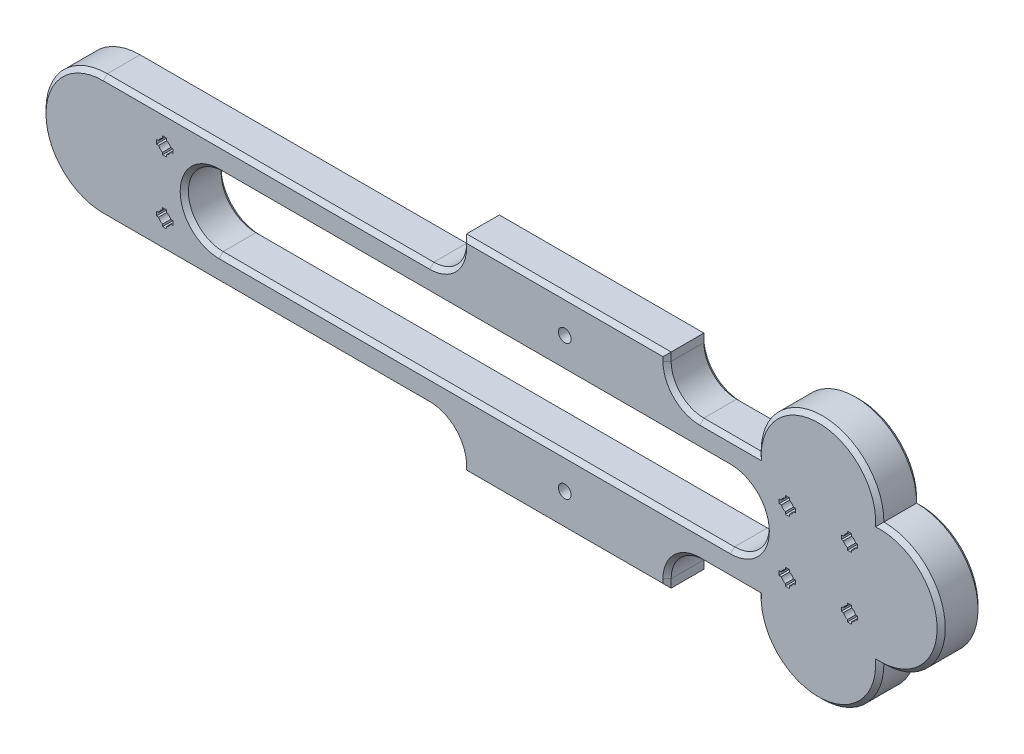
from build123d import *

# Parameters (mm, degrees)
SKETCH1_R           = 1.55
SKETCH1_W           = 57.8
SKETCH1_H           = 30
SKETCH1_W_2         = 22
SKETCH1_W_3         = 30
BOSS_EXTRUDE1_DEPTH = 10
FILLET2_R           = 8
CHAMFER1_SIZE       = 1
SKETCH2_R           = 3.25
CUT_EXTRUDE1_DEPTH  = 3
CUT_EXTRUDE2_DEPTH  = 137.363814848
CHAMFER2_SIZE       = 1


with BuildPart() as part:
    # Sketch1 → Boss-Extrude1 (new body)
    # profile 1 of 9: a face of its own
    with BuildSketch(Plane.XY):
        Polygon((-25, -31.5), (-25, -41.5), (25, -41.5), (25, -31.5), (25, -1.5), (25, 8.5), (-25, 8.5), (-25, -1.5), align=None)
        with Locations((0, -33)):
            Circle(SKETCH1_R, mode=Mode.SUBTRACT)
        Circle(SKETCH1_R, mode=Mode.SUBTRACT)
    # profile 2 of 9: a face of its own
    with BuildSketch(Plane.XY):
        with Locations((-53.9, -16.5)):
            Rectangle(SKETCH1_W, SKETCH1_H)
    # profile 3 of 9: a face of its own
    with BuildSketch(Plane.XY):
        with Locations((36, -16.5)):
            Rectangle(SKETCH1_W_2, SKETCH1_H)
    # profile 4 of 9: a face of its own
    with BuildSketch(Plane.XY):
        with Locations((-97.8, -16.5)):
            Rectangle(SKETCH1_W_3, SKETCH1_H)
        with BuildLine():
            Line((-99.8, -24.6), (-99.8, -23.6))
            Line((-99.8, -23.6), (-99.267140075, -23.6))
            ThreePointArc((-99.267140075, -23.6), (-98.896015511, -23.003984489), (-98.3, -22.632859925))
            Line((-98.3, -22.632859925), (-98.3, -22.1))
            Line((-98.3, -22.1), (-97.3, -22.1))
            Line((-97.3, -22.1), (-97.3, -22.632859925))
            ThreePointArc((-97.3, -22.632859925), (-96.703984489, -23.003984489), (-96.332859925, -23.6))
            Line((-96.332859925, -23.6), (-95.8, -23.6))
            Line((-95.8, -23.6), (-95.8, -24.6))
            Line((-95.8, -24.6), (-96.332859925, -24.6))
            ThreePointArc((-96.332859925, -24.6), (-96.703984489, -25.196015511), (-97.3, -25.567140075))
            Line((-97.3, -25.567140075), (-97.3, -26.1))
            Line((-97.3, -26.1), (-98.3, -26.1))
            Line((-98.3, -26.1), (-98.3, -25.567140075))
            ThreePointArc((-98.3, -25.567140075), (-98.896015511, -25.196015511), (-99.267140075, -24.6))
            Line((-99.267140075, -24.6), (-99.8, -24.6))
        make_face(mode=Mode.SUBTRACT)
        with BuildLine():
            Line((-97.3, -10.9), (-98.3, -10.9))
            Line((-98.3, -10.9), (-98.3, -10.367140075))
            ThreePointArc((-98.3, -10.367140075), (-98.896015511, -9.996015511), (-99.267140075, -9.4))
            Line((-99.267140075, -9.4), (-99.8, -9.4))
            Line((-99.8, -9.4), (-99.8, -8.4))
            Line((-99.8, -8.4), (-99.267140075, -8.4))
            ThreePointArc((-99.267140075, -8.4), (-98.896015511, -7.803984489), (-98.3, -7.432859925))
            Line((-98.3, -7.432859925), (-98.3, -6.9))
            Line((-98.3, -6.9), (-97.3, -6.9))
            Line((-97.3, -6.9), (-97.3, -7.432859925))
            ThreePointArc((-97.3, -7.432859925), (-96.703984489, -7.803984489), (-96.332859925, -8.4))
            Line((-96.332859925, -8.4), (-95.8, -8.4))
            Line((-95.8, -8.4), (-95.8, -9.4))
            Line((-95.8, -9.4), (-96.332859925, -9.4))
            ThreePointArc((-96.332859925, -9.4), (-96.703984489, -9.996015511), (-97.3, -10.367140075))
            Line((-97.3, -10.367140075), (-97.3, -10.9))
        make_face(mode=Mode.SUBTRACT)
    # profile 5 of 9: a face of its own
    with BuildSketch(Plane.XY):
        with Locations((62, -16.5)):
            Rectangle(SKETCH1_W_3, SKETCH1_H)
        with BuildLine():
            Line((55.867140075, -23.6), (56.4, -23.6))
            Line((56.4, -23.6), (56.4, -24.6))
            Line((56.4, -24.6), (55.867140075, -24.6))
            ThreePointArc((55.867140075, -24.6), (55.496015511, -25.196015511), (54.9, -25.567140075))
            Line((54.9, -25.567140075), (54.9, -26.1))
            Line((54.9, -26.1), (53.9, -26.1))
            Line((53.9, -26.1), (53.9, -25.567140075))
            ThreePointArc((53.9, -25.567140075), (53.303984489, -25.196015511), (52.932859925, -24.6))
            Line((52.932859925, -24.6), (52.4, -24.6))
            Line((52.4, -24.6), (52.4, -23.6))
            Line((52.4, -23.6), (52.932859925, -23.6))
            ThreePointArc((52.932859925, -23.6), (53.303984489, -23.003984489), (53.9, -22.632859925))
            Line((53.9, -22.632859925), (53.9, -22.1))
            Line((53.9, -22.1), (54.9, -22.1))
            Line((54.9, -22.1), (54.9, -22.632859925))
            ThreePointArc((54.9, -22.632859925), (55.496015511, -23.003984489), (55.867140075, -23.6))
        make_face(mode=Mode.SUBTRACT)
        with BuildLine():
            Line((67.6, -24.6), (67.6, -23.6))
            Line((67.6, -23.6), (68.132859925, -23.6))
            ThreePointArc((68.132859925, -23.6), (68.503984489, -23.003984489), (69.1, -22.632859925))
            Line((69.1, -22.632859925), (69.1, -22.1))
            Line((69.1, -22.1), (70.1, -22.1))
            Line((70.1, -22.1), (70.1, -22.632859925))
            ThreePointArc((70.1, -22.632859925), (70.696015511, -23.003984489), (71.067140075, -23.6))
            Line((71.067140075, -23.6), (71.6, -23.6))
            Line((71.6, -23.6), (71.6, -24.6))
            Line((71.6, -24.6), (71.067140075, -24.6))
            ThreePointArc((71.067140075, -24.6), (70.696015511, -25.196015511), (70.1, -25.567140075))
            Line((70.1, -25.567140075), (70.1, -26.1))
            Line((70.1, -26.1), (69.1, -26.1))
            Line((69.1, -26.1), (69.1, -25.567140075))
            ThreePointArc((69.1, -25.567140075), (68.503984489, -25.196015511), (68.132859925, -24.6))
            Line((68.132859925, -24.6), (67.6, -24.6))
        make_face(mode=Mode.SUBTRACT)
        with BuildLine():
            Line((56.4, -8.4), (56.4, -9.4))
            Line((56.4, -9.4), (55.867140075, -9.4))
            ThreePointArc((55.867140075, -9.4), (55.496015511, -9.996015511), (54.9, -10.367140075))
            Line((54.9, -10.367140075), (54.9, -10.9))
            Line((54.9, -10.9), (53.9, -10.9))
            Line((53.9, -10.9), (53.9, -10.367140075))
            ThreePointArc((53.9, -10.367140075), (53.303984489, -9.996015511), (52.932859925, -9.4))
            Line((52.932859925, -9.4), (52.4, -9.4))
            Line((52.4, -9.4), (52.4, -8.4))
            Line((52.4, -8.4), (52.932859925, -8.4))
            ThreePointArc((52.932859925, -8.4), (53.303984489, -7.803984489), (53.9, -7.432859925))
            Line((53.9, -7.432859925), (53.9, -6.9))
            Line((53.9, -6.9), (54.9, -6.9))
            Line((54.9, -6.9), (54.9, -7.432859925))
            ThreePointArc((54.9, -7.432859925), (55.496015511, -7.803984489), (55.867140075, -8.4))
            Line((55.867140075, -8.4), (56.4, -8.4))
        make_face(mode=Mode.SUBTRACT)
        with BuildLine():
            Line((70.1, -10.9), (69.1, -10.9))
            Line((69.1, -10.9), (69.1, -10.367140075))
            ThreePointArc((69.1, -10.367140075), (68.503984489, -9.996015511), (68.132859925, -9.4))
            Line((68.132859925, -9.4), (67.6, -9.4))
            Line((67.6, -9.4), (67.6, -8.4))
            Line((67.6, -8.4), (68.132859925, -8.4))
            ThreePointArc((68.132859925, -8.4), (68.503984489, -7.803984489), (69.1, -7.432859925))
            Line((69.1, -7.432859925), (69.1, -6.9))
            Line((69.1, -6.9), (70.1, -6.9))
            Line((70.1, -6.9), (70.1, -7.432859925))
            ThreePointArc((70.1, -7.432859925), (70.696015511, -7.803984489), (71.067140075, -8.4))
            Line((71.067140075, -8.4), (71.6, -8.4))
            Line((71.6, -8.4), (71.6, -9.4))
            Line((71.6, -9.4), (71.067140075, -9.4))
            ThreePointArc((71.067140075, -9.4), (70.696015511, -9.996015511), (70.1, -10.367140075))
            Line((70.1, -10.367140075), (70.1, -10.9))
        make_face(mode=Mode.SUBTRACT)
    # profile 6 of 9: a face of its own
    with BuildSketch(Plane.XY):
        with BuildLine():
            Line((77, -31.5), (47, -31.5))
            ThreePointArc((47, -31.5), (62, -46.5), (77, -31.5))
        make_face()
    # profile 7 of 9: a face of its own
    with BuildSketch(Plane.XY):
        with BuildLine():
            ThreePointArc((-112.8, -1.5), (-127.8, -16.5), (-112.8, -31.5))
            Line((-112.8, -31.5), (-112.8, -1.5))
        make_face()
    # profile 8 of 9: a face of its own
    with BuildSketch(Plane.XY):
        with BuildLine():
            ThreePointArc((77, -1.5), (62, 13.5), (47, -1.5))
            Line((47, -1.5), (77, -1.5))
        make_face()
    # profile 9 of 9: a face of its own
    with BuildSketch(Plane.XY):
        with BuildLine():
            Line((77, -1.5), (77, -31.5))
            ThreePointArc((77, -31.5), (92, -16.5), (77, -1.5))
        make_face()
    extrude(amount=BOSS_EXTRUDE1_DEPTH)

    # Fillet2
    fillet2_edges = [part.edges().sort_by_distance(p)[0] for p in [
        (-25, -1.5, 5),
        (25, -1.5, 5),
        (25, -31.5, 5),
        (-25, -31.5, 5),
    ]]
    fillet(fillet2_edges, radius=FILLET2_R)

    # Chamfer1
    chamfer1_edges = [part.edges().sort_by_distance(p)[0] for p in [
        (-127.8, -16.5, 10),
        (-72.9, -1.5, 0),
        (0, 8.5, 0),
        (40, -1.5, 0),
        (62, 13.5, 0),
        (92, -16.5, 0),
        (62, -46.5, 0),
        (40, -31.5, 0),
        (25, -40.5, 0),
        (0, -41.5, 0),
        (-25, -40.5, 0),
        (-72.9, -31.5, 0),
        (-127.8, -16.5, 0),
        (-72.9, -31.5, 10),
        (-25, -40.5, 10),
        (0, -41.5, 10),
        (25, 7.5, 0),
        (25, 7.5, 10),
        (-25, 7.5, 0),
        (-25, 7.5, 10),
        (27.343145751, 0.843145751, 0),
        (27.343145751, 0.843145751, 10),
        (27.343145751, -33.843145751, 0),
        (27.343145751, -33.843145751, 10),
        (25, -40.5, 10),
        (-27.343145751, -33.843145751, 0),
        (-27.343145751, -33.843145751, 10),
        (-27.343145751, 0.843145751, 0),
        (-27.343145751, 0.843145751, 10),
        (40, -31.5, 10),
        (62, -46.5, 10),
        (92, -16.5, 10),
        (62, 13.5, 10),
        (40, -1.5, 10),
        (0, 8.5, 10),
        (-72.9, -1.5, 10),
    ]]
    chamfer(chamfer1_edges, length=CHAMFER1_SIZE)

    # Sketch2 → Cut-Extrude1 (cut)
    with BuildSketch(Plane(origin=(0, 0, 0), x_dir=(-1, 0, 0), z_dir=(0, 0, -1))):
        Circle(SKETCH2_R)
        with Locations((0, -33)):
            Circle(SKETCH2_R)
    extrude(amount=-CUT_EXTRUDE1_DEPTH, mode=Mode.SUBTRACT)

    # Sketch3 → Cut-Extrude2 (cut, through all)
    with BuildSketch(Plane.XY.offset(10)):
        with BuildLine():
            Line((-84.5, -8), (40.5, -8))
            ThreePointArc((40.5, -8), (49, -16.5), (40.5, -25))
            Line((40.5, -25), (-84.5, -25))
            ThreePointArc((-84.5, -25), (-93, -16.5), (-84.5, -8))
        make_face()
    extrude(amount=-CUT_EXTRUDE2_DEPTH, mode=Mode.SUBTRACT)

    # Chamfer2
    chamfer2_edges = [part.edges().sort_by_distance(p)[0] for p in [
        (-93, -16.5, 0),
        (-22, -8, 0),
        (49, -16.5, 0),
        (-22, -25, 0),
        (-93, -16.5, 10),
        (-22, -25, 10),
        (49, -16.5, 10),
        (-22, -8, 10),
    ]]
    chamfer(chamfer2_edges, length=CHAMFER2_SIZE)


solid = part.part
